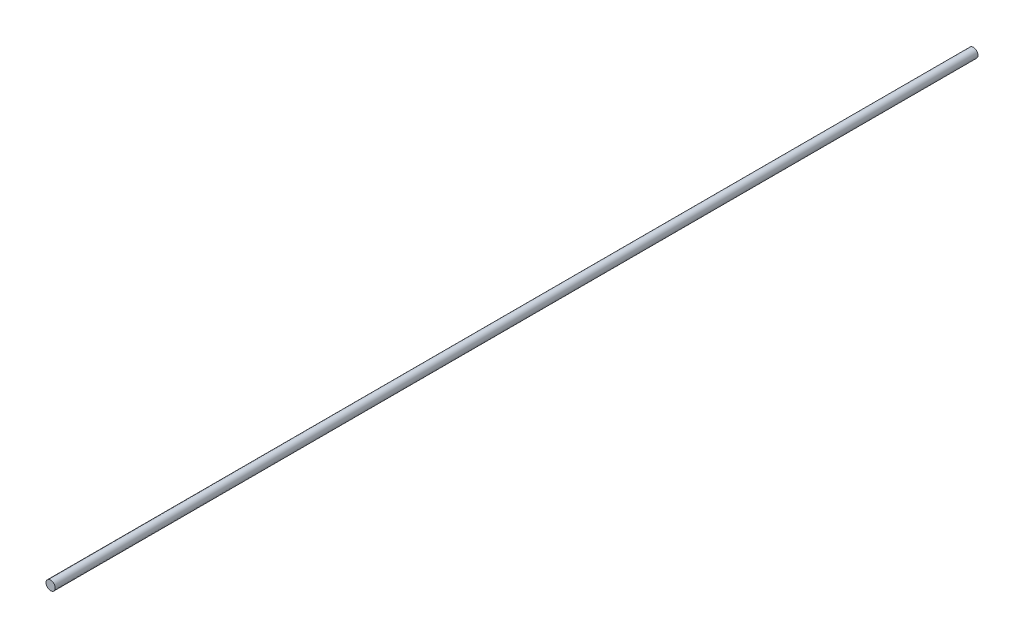
from build123d import *

# Parameters (mm, degrees)
SKETCH_1_R      = 0.75
EXTRUDE_1_DEPTH = 150


with BuildPart() as part:
    # 草图1 → 凸台-拉伸1 (new body)
    with BuildSketch(Plane.XY):
        Circle(SKETCH_1_R)
    extrude(amount=EXTRUDE_1_DEPTH)


solid = part.part
